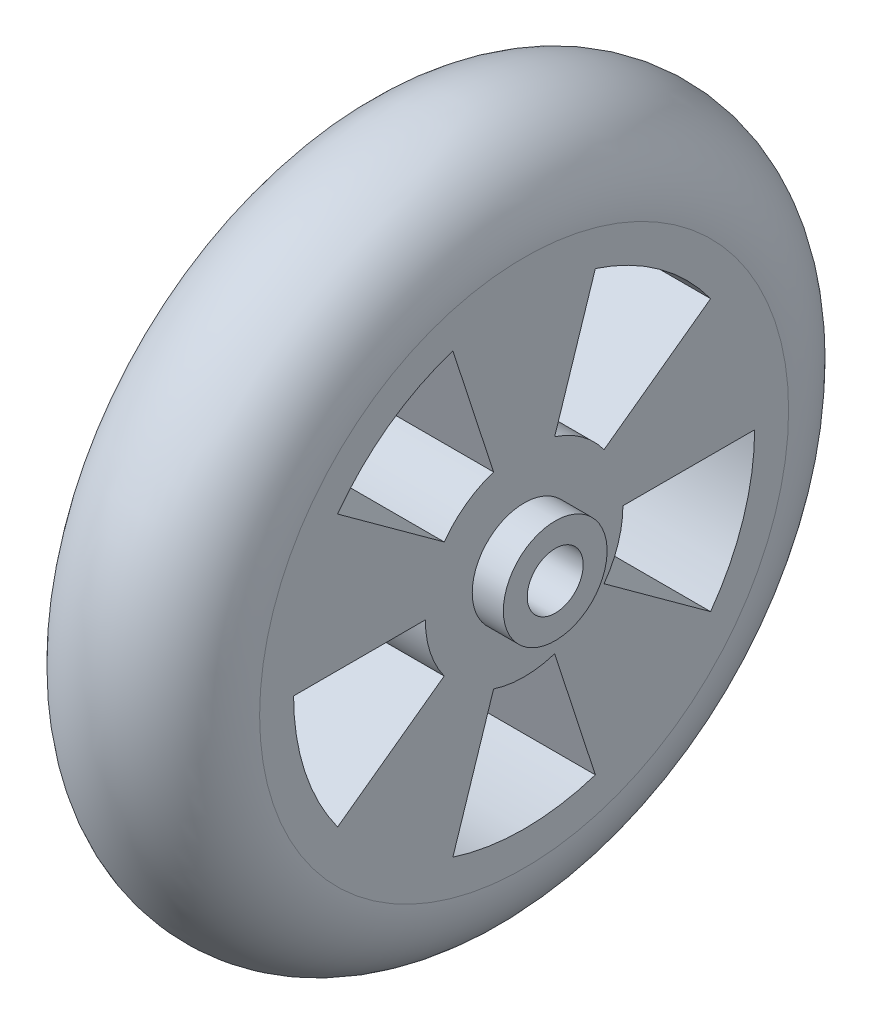
from build123d import *

# Parameters (mm, degrees)
SKETCH2_R          = 2.7
CUT_EXTRUDE1_DEPTH = 53.076866396
CUT_EXTRUDE2_DEPTH = 53.076866396


with BuildPart() as part:
    # Sketch1 → Revolve1 (revolve)
    with BuildSketch(Plane.XY, mode=Mode.PRIVATE) as revolve1_sk:
        with BuildLine():
            Line((0, 25.5), (0, 0))
            Line((0, 0), (20, 0))
            Line((20, 0), (20, 5))
            Line((20, 5), (17, 5))
            Line((17, 5), (17, 25.5))
            ThreePointArc((17, 25.5), (8.5, 34), (0, 25.5))
        make_face()
    revolve(revolve1_sk.sketch.rotate(Axis((0, 0, 0), (1, 0, 0)), 90), axis=Axis((0, 0, 0), (1, 0, 0)))

    # Sketch2 → Cut-Extrude1 (cut, through all)
    with BuildSketch(Plane(origin=(0, 0, 0), x_dir=(0, 0, -1), z_dir=(1, 0, 0))):
        Circle(SKETCH2_R)
    extrude(amount=CUT_EXTRUDE1_DEPTH, mode=Mode.SUBTRACT)

    # Sketch3 → Cut-Extrude2 (cut, through all)
    with BuildSketch(Plane(origin=(0, 0, 0), x_dir=(0, 0, -1), z_dir=(1, 0, 0))):
        with BuildLine():
            Line((-17.9804027, 13.063527232), (-7.705886871, 5.598654528))
            ThreePointArc((-7.705886871, 5.598654528), (-5.598654528, 7.705886871), (-2.943386871, 9.058813318))
            Line((-2.943386871, 9.058813318), (-6.8679027, 21.137231075))
            ThreePointArc((-6.8679027, 21.137231075), (-13.063527232, 17.9804027), (-17.9804027, 13.063527232))
        make_face()
        with BuildLine():
            Line((6.8679027, 21.137231075), (2.943386871, 9.058813318))
            ThreePointArc((2.943386871, 9.058813318), (5.598654528, 7.705886871), (7.705886871, 5.598654528))
            Line((7.705886871, 5.598654528), (17.9804027, 13.063527232))
            ThreePointArc((17.9804027, 13.063527232), (13.063527232, 17.9804027), (6.8679027, 21.137231075))
        make_face()
        with BuildLine():
            Line((22.225, 0), (9.525, 0))
            ThreePointArc((9.525, 0), (9.058813318, -2.943386871), (7.705886871, -5.598654528))
            Line((7.705886871, -5.598654528), (17.9804027, -13.063527232))
            ThreePointArc((17.9804027, -13.063527232), (21.137231075, -6.8679027), (22.225, 0))
        make_face()
        with BuildLine():
            Line((6.8679027, -21.137231075), (2.943386871, -9.058813318))
            ThreePointArc((2.943386871, -9.058813318), (0, -9.525), (-2.943386871, -9.058813318))
            Line((-2.943386871, -9.058813318), (-6.8679027, -21.137231075))
            ThreePointArc((-6.8679027, -21.137231075), (0, -22.225), (6.8679027, -21.137231075))
        make_face()
        with BuildLine():
            Line((-17.9804027, -13.063527232), (-7.705886871, -5.598654528))
            ThreePointArc((-7.705886871, -5.598654528), (-9.058813318, -2.943386871), (-9.525, 0))
            Line((-9.525, 0), (-22.225, 0))
            ThreePointArc((-22.225, 0), (-21.137231075, -6.8679027), (-17.9804027, -13.063527232))
        make_face()
    extrude(amount=CUT_EXTRUDE2_DEPTH, mode=Mode.SUBTRACT)


solid = part.part
